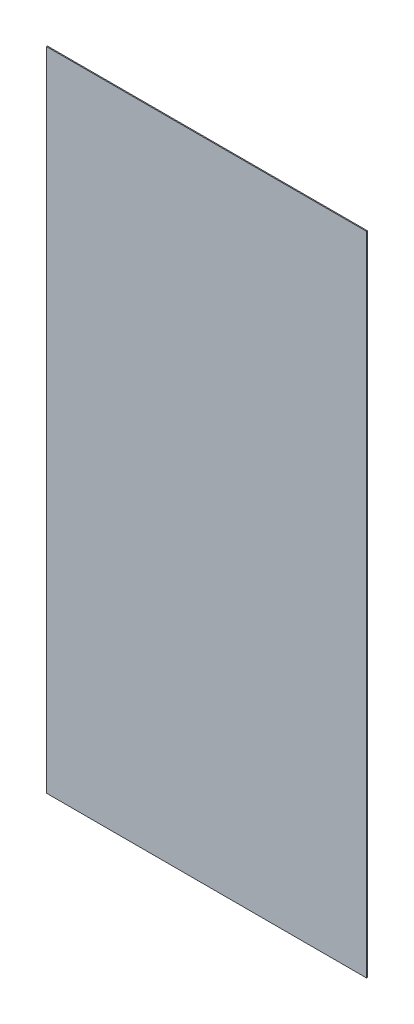
from build123d import *

# Parameters (mm, degrees)
CROQUIS1_W              = 980
CROQUIS1_H              = 1980
CROQUIS1_W_2            = 940
CROQUIS1_H_2            = 1940
SALIENTE_EXTRUIR1_DEPTH = 3


with BuildPart() as part:
    # Croquis1 → Saliente-Extruir1 (new body)
    # profile 1 of 2: a face of its own
    with BuildSketch(Plane.XY):
        with Locations((500, 1000)):
            Rectangle(CROQUIS1_W, CROQUIS1_H)
        with Locations((500, 1000)):
            Rectangle(CROQUIS1_W_2, CROQUIS1_H_2, mode=Mode.SUBTRACT)
    # profile 2 of 2: a face of its own
    with BuildSketch(Plane.XY):
        with Locations((500, 1000)):
            Rectangle(CROQUIS1_W_2, CROQUIS1_H_2)
    extrude(amount=SALIENTE_EXTRUIR1_DEPTH)


solid = part.part
